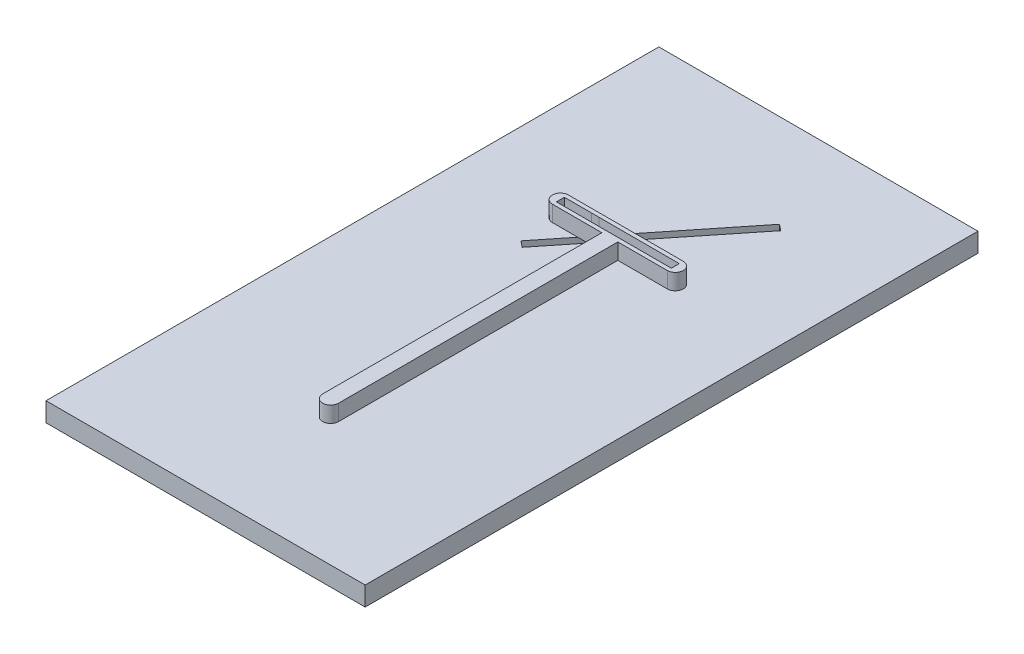
from build123d import *

# Parameters (mm, degrees)
SKETCH1_W           = 200
SKETCH1_H           = 384.014252746
BOSS_EXTRUDE2_DEPTH = 12
BOSS_EXTRUDE4_START = 2
BOSS_EXTRUDE4_DEPTH = 10


with BuildPart() as part:
    # Sketch1 → Boss-Extrude2 (new body)
    with BuildSketch(Plane(origin=(0, 0, 0), x_dir=(1, 0, 0), z_dir=(0, 1, 0))):
        with Locations((0, -87.007126373)):
            Rectangle(SKETCH1_W, SKETCH1_H)
        Polygon((-34.047827976, -46.561737619), (-37.952172024, -43.438262381), (-17.749031902, -18.184337229), (-18.882263977, -18.184337229), (-18.882263977, -18.171171442), (-17.738499272, -18.171171442), (34.047827976, 46.561737619), (37.952172024, 43.438262381), (-15.345907664, -23.184337229), (-14.212675588, -23.184337229), (-14.212675588, -23.197503015), (-15.356440294, -23.197503015), align=None, mode=Mode.SUBTRACT)
    extrude(amount=-BOSS_EXTRUDE2_DEPTH)


with BuildPart() as body_2:
    # Sketch1<5> → Boss-Extrude4 (new body)
    with BuildSketch(Plane(origin=(0, 0, 0), x_dir=(1, 0, 0), z_dir=(0, 1, 0)).offset(BOSS_EXTRUDE4_START)):
        with BuildLine():
            ThreePointArc((-5, -200.684337229), (0, -205.684337229), (5, -200.684337229))
            Line((5, -200.684337229), (5, -25.684337229))
            Line((5, -25.684337229), (36, -25.684337229))
            ThreePointArc((36, -25.684337229), (41, -20.684337229), (36, -15.684337229))
            Line((36, -15.684337229), (-36, -15.684337229))
            ThreePointArc((-36, -15.684337229), (-41, -20.684337229), (-36, -25.684337229))
            Line((-36, -25.684337229), (-5, -25.684337229))
            Line((-5, -25.684337229), (-5, -200.684337229))
        make_face()
        Polygon((-14.212675588, -23.184337229), (-14.212675588, -23.197503015), (-18.882263977, -23.197503015), (-18.882263977, -23.184337229), (-36, -23.184337229), (-36, -18.184337229), (-18.882263977, -18.184337229), (-18.882263977, -18.171171442), (-14.212675588, -18.171171442), (-14.212675588, -18.184337229), (36, -18.184337229), (36, -23.184337229), align=None, mode=Mode.SUBTRACT)
    extrude(amount=BOSS_EXTRUDE4_DEPTH)


solid = Compound([part.part, body_2.part])
